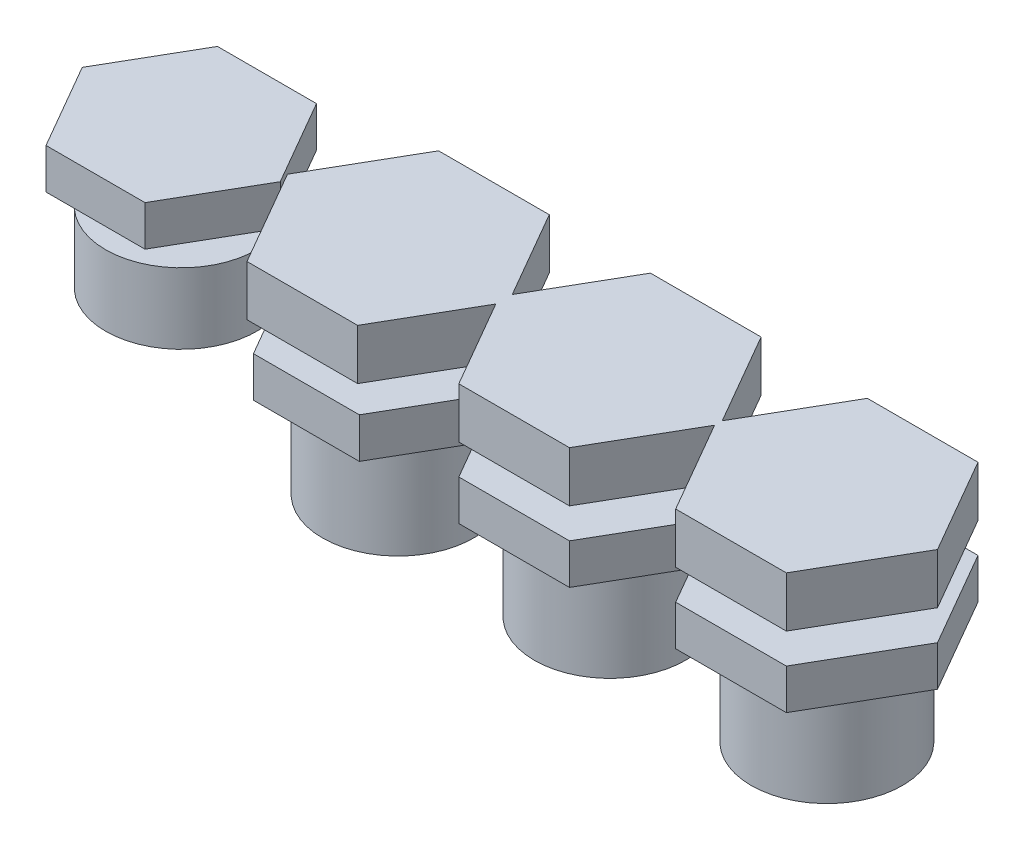
from build123d import *

# Parameters (mm, degrees)
BOSS_EXTRUDE1_DEPTH  = 4
SKETCH2_R            = 7.5
BOSS_EXTRUDE2_DEPTH  = 10
BOSS_EXTRUDE3_DEPTH  = 5
BOSS_EXTRUDE4_DEPTH  = 4
SKETCH5_R            = 7.5
BOSS_EXTRUDE5_DEPTH  = 10
BOSS_EXTRUDE6_DEPTH  = 5
BOSS_EXTRUDE7_DEPTH  = 4
SKETCH8_R            = 7.5
BOSS_EXTRUDE8_DEPTH  = 10
BOSS_EXTRUDE9_DEPTH  = 5
SKETCH10_R           = 7.5
BOSS_EXTRUDE10_DEPTH = 7
BOSS_EXTRUDE11_DEPTH = 4


with BuildPart() as part:
    # Sketch1 → Boss-Extrude1 (new body)
    with BuildSketch(Plane(origin=(0, -86.5, 0), x_dir=(1, 0, 0), z_dir=(0, 1, 0))):
        Polygon((0, -26), (-5.25, -16.90673326), (-15.75, -16.90673326), (-21, -26), (-15.75, -35.09326674), (-5.25, -35.09326674), align=None)
    extrude(amount=BOSS_EXTRUDE1_DEPTH)

    # Sketch2 → Boss-Extrude2 (add)
    with BuildSketch(Plane(origin=(0, -96.5, 0), x_dir=(1, 0, 0), z_dir=(0, 1, 0))):
        with Locations(Location((-10.5, -26, 0), (0, 0, 270))):
            Circle(SKETCH2_R)
    extrude(amount=BOSS_EXTRUDE2_DEPTH)

    # Sketch4 → Boss-Extrude4 (add)
    with BuildSketch(Plane(origin=(0, -86.5, 0), x_dir=(1, 0, 0), z_dir=(0, 1, 0))):
        Polygon((21.469655115, -26), (15.984827557, -16.5), (5.015172443, -16.5), (-0.469655115, -26), (5.015172443, -35.5), (15.984827557, -35.5), align=None)
    extrude(amount=BOSS_EXTRUDE4_DEPTH)

    # Sketch5 → Boss-Extrude5 (add)
    with BuildSketch(Plane(origin=(0, -96.5, 0), x_dir=(1, 0, 0), z_dir=(0, 1, 0))):
        with Locations(Location((10.5, -26, 0), (0, 0, 270))):
            Circle(SKETCH5_R)
    extrude(amount=BOSS_EXTRUDE5_DEPTH)

    # Sketch7 → Boss-Extrude7 (add)
    with BuildSketch(Plane(origin=(0, -86.5, 0), x_dir=(1, 0, 0), z_dir=(0, 1, 0))):
        Polygon((42.969655115, -26), (37.484827557, -16.5), (26.515172443, -16.5), (21.030344885, -26), (26.515172443, -35.5), (37.484827557, -35.5), align=None)
    extrude(amount=BOSS_EXTRUDE7_DEPTH)

    # Sketch8 → Boss-Extrude8 (add)
    with BuildSketch(Plane(origin=(0, -96.5, 0), x_dir=(1, 0, 0), z_dir=(0, 1, 0))):
        with Locations(Location((32, -26, 0), (0, 0, 270))):
            Circle(SKETCH8_R)
    extrude(amount=BOSS_EXTRUDE8_DEPTH)


with BuildPart() as body_2:
    # Sketch3 → Boss-Extrude3 (new body)
    with BuildSketch(Plane(origin=(0, -79.5, 0), x_dir=(1, 0, 0), z_dir=(0, 1, 0))):
        Polygon((0.469655115, -26), (-5.015172443, -16.5), (-15.984827557, -16.5), (-21.469655115, -26), (-15.984827557, -35.5), (-5.015172443, -35.5), align=None)
    extrude(amount=BOSS_EXTRUDE3_DEPTH)

    # Sketch6 → Boss-Extrude6 (add)
    with BuildSketch(Plane(origin=(0, -79.5, 0), x_dir=(1, 0, 0), z_dir=(0, 1, 0))):
        Polygon((21.469655115, -26), (15.984827557, -16.5), (5.015172443, -16.5), (-0.469655115, -26), (5.015172443, -35.5), (15.984827557, -35.5), align=None)
    extrude(amount=BOSS_EXTRUDE6_DEPTH)

    # Sketch9 → Boss-Extrude9 (add)
    with BuildSketch(Plane(origin=(0, -79.5, 0), x_dir=(1, 0, 0), z_dir=(0, 1, 0))):
        Polygon((42.969655115, -26), (37.484827557, -16.5), (26.515172443, -16.5), (21.030344885, -26), (26.515172443, -35.5), (37.484827557, -35.5), align=None)
    extrude(amount=BOSS_EXTRUDE9_DEPTH)


with BuildPart() as body_3:
    # Sketch10 → Boss-Extrude10 (new body)
    with BuildSketch(Plane(origin=(0, -89.5, 0), x_dir=(1, 0, 0), z_dir=(0, 1, 0))):
        with Locations(Location((-32, -26, 0), (0, 0, 270))):
            Circle(SKETCH10_R)
    extrude(amount=BOSS_EXTRUDE10_DEPTH)


with BuildPart() as body_4:
    # Sketch11 → Boss-Extrude11 (new body)
    with BuildSketch(Plane(origin=(0, -79.5, 0), x_dir=(1, 0, 0), z_dir=(0, 1, 0))):
        Polygon((-22.185045424, -26), (-27.092522712, -17.5), (-36.907477288, -17.5), (-41.814954576, -26), (-36.907477288, -34.5), (-27.092522712, -34.5), align=None)
    extrude(amount=BOSS_EXTRUDE11_DEPTH)


solid = Compound([part.part, body_2.part, body_3.part, body_4.part])
